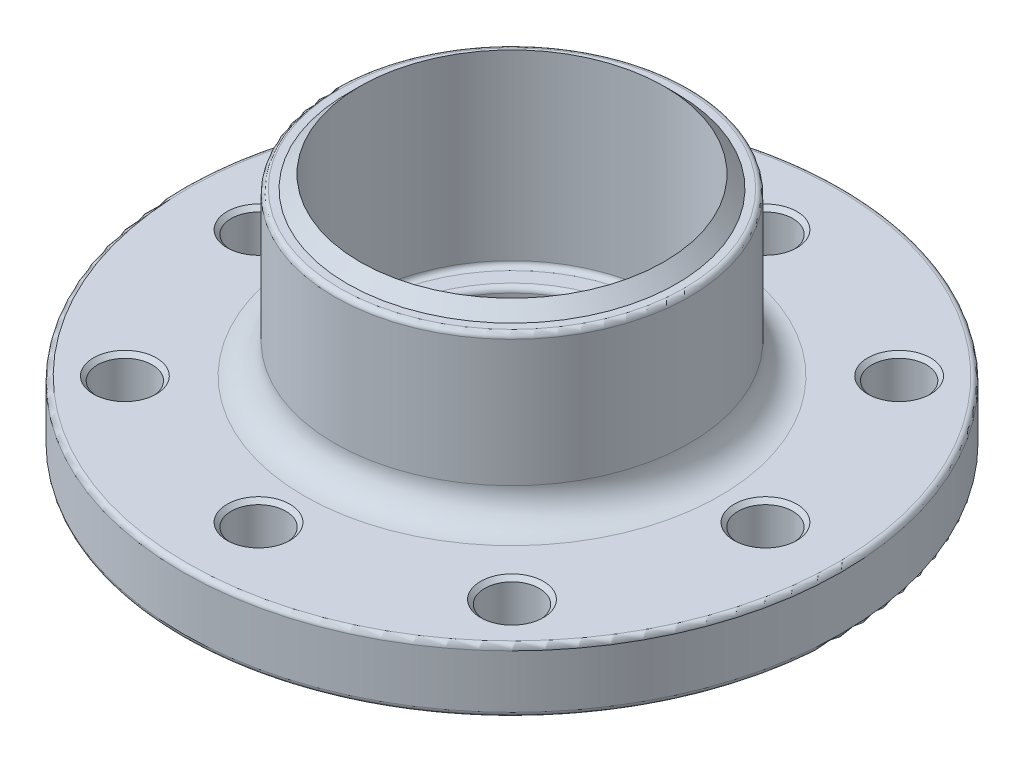
from build123d import *

# Parameters (mm, degrees)
FILETE1_R             = 6
FILETE2_R             = 1
FILETE3_R             = 1
ESBO_O2_R             = 5.4
CORTE_EXTRUS_O1_DEPTH = 104.2424332
ESBO_O3_R             = 5.4
CORTE_EXTRUS_O2_DEPTH = 104.2424332
CHANFRO1_SIZE         = 0.8


with BuildPart() as part:
    # Esboço1 → Revolução1 (revolve)
    with BuildSketch(Plane.XY, mode=Mode.PRIVATE) as revolu_o1_sk:
        Polygon((30, 49.183222591), (32.5, 46.683222591), (35, 46.683222591), (35, 14.683222591), (65, 14.683222591), (65, 2.183222591), (27.5, 2.183222591), (27.5, -15.816777409), (25, -15.816777409), (25, 12.183222591), (30, 12.183222591), align=None)
    revolve(revolu_o1_sk.sketch.rotate(Axis((0, -46.981561462, 0), (0, 1, 0)), 90), axis=Axis((0, -46.981561462, 0), (0, 1, 0)))

    # Filete1
    filete1_edges = [part.edges().sort_by_distance(p)[0] for p in [
        (0, 14.683222591, 35),
    ]]
    fillet(filete1_edges, radius=FILETE1_R)

    # Filete2
    filete2_edges = [part.edges().sort_by_distance(p)[0] for p in [
        (0, 14.683222591, 65),
        (0, 46.683222591, 35),
        (0, 12.183222591, 30),
        (0, 2.183222591, 65),
    ]]
    fillet(filete2_edges, radius=FILETE2_R)

    # Filete3
    filete3_edges = [part.edges().sort_by_distance(p)[0] for p in [
        (0, 12.183222591, 25),
        (0, -15.816777409, 25),
        (0, -15.816777409, 27.5),
        (0, 2.183222591, 27.5),
    ]]
    fillet(filete3_edges, radius=FILETE3_R)

    # Esboço2 → Corte-extrusão1 (cut, through all)
    with BuildSketch(Plane(origin=(0, 2.183222591, 0), x_dir=(-1, 0, 0), z_dir=(0, -1, 0))):
        with Locations(Location((0, -50, 0), (0, 0, 90))):
            Circle(ESBO_O2_R)
        with Locations(Location((-50, 0, 0), (0, 0, 90))):
            Circle(ESBO_O2_R)
        with Locations(Location((0, 50, 0), (0, 0, 90))):
            Circle(ESBO_O2_R)
        with Locations(Location((50, 0, 0), (0, 0, 90))):
            Circle(ESBO_O2_R)
    extrude(amount=-CORTE_EXTRUS_O1_DEPTH, mode=Mode.SUBTRACT)

    # Esboço3 → Corte-extrusão2 (cut, through all)
    with BuildSketch(Plane(origin=(0, 2.183222591, 0), x_dir=(-1, 0, 0), z_dir=(0, -1, 0))):
        with Locations(Location((38.183766184, -38.183766184, 0), (0, 0, 90))):
            Circle(ESBO_O3_R)
        with Locations(Location((-38.183766184, -38.183766184, 0), (0, 0, 90))):
            Circle(ESBO_O3_R)
        with Locations(Location((-38.183766184, 38.183766184, 0), (0, 0, 90))):
            Circle(ESBO_O3_R)
        with Locations(Location((38.183766184, 38.183766184, 0), (0, 0, 90))):
            Circle(ESBO_O3_R)
    extrude(amount=-CORTE_EXTRUS_O2_DEPTH, mode=Mode.SUBTRACT)

    # Chanfro1
    chanfro1_edges = [part.edges().sort_by_distance(p)[0] for p in [
        (0, 14.683222591, 55.4),
        (0, 2.183222591, 55.4),
        (50, 14.683222591, 5.4),
        (50, 2.183222591, 5.4),
        (0, 14.683222591, -44.6),
        (0, 2.183222591, -44.6),
        (-50, 14.683222591, 5.4),
        (-50, 2.183222591, 5.4),
        (-38.183766184, 14.683222591, 43.583766184),
        (-38.183766184, 2.183222591, 43.583766184),
        (38.183766184, 14.683222591, 43.583766184),
        (38.183766184, 2.183222591, 43.583766184),
        (38.183766184, 14.683222591, -32.783766184),
        (38.183766184, 2.183222591, -32.783766184),
        (-38.183766184, 14.683222591, -32.783766184),
        (-38.183766184, 2.183222591, -32.783766184),
    ]]
    chamfer(chanfro1_edges, length=CHANFRO1_SIZE)


solid = part.part
